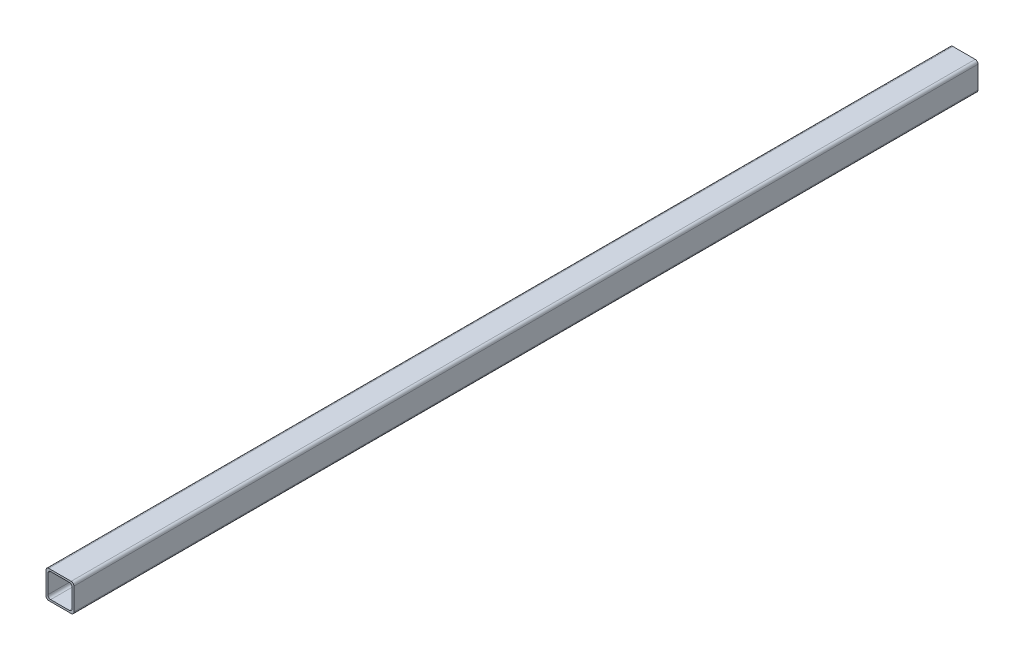
from build123d import *

# Parameters (mm, degrees)
BOSS_EXTRU_1_DEPTH = 970


with BuildPart() as part:
    # Esquisse1 → Boss.-Extru.1 (new body)
    with BuildSketch(Plane.XY):
        with BuildLine():
            Line((-12, -15), (12, -15))
            ThreePointArc((12, -15), (14.121320344, -14.121320344), (15, -12))
            Line((15, -12), (15, 12))
            ThreePointArc((15, 12), (14.121320344, 14.121320344), (12, 15))
            Line((12, 15), (-12, 15))
            ThreePointArc((-12, 15), (-14.121320344, 14.121320344), (-15, 12))
            Line((-15, 12), (-15, -12))
            ThreePointArc((-15, -12), (-14.121320344, -14.121320344), (-12, -15))
        make_face()
        with BuildLine():
            Line((-10, -13), (10, -13))
            ThreePointArc((10, -13), (12.121320344, -12.121320344), (13, -10))
            Line((13, -10), (13, 10))
            ThreePointArc((13, 10), (12.121320344, 12.121320344), (10, 13))
            Line((10, 13), (-10, 13))
            ThreePointArc((-10, 13), (-12.121320344, 12.121320344), (-13, 10))
            Line((-13, 10), (-13, -10))
            ThreePointArc((-13, -10), (-12.121320344, -12.121320344), (-10, -13))
        make_face(mode=Mode.SUBTRACT)
    extrude(amount=-BOSS_EXTRU_1_DEPTH)


solid = part.part
